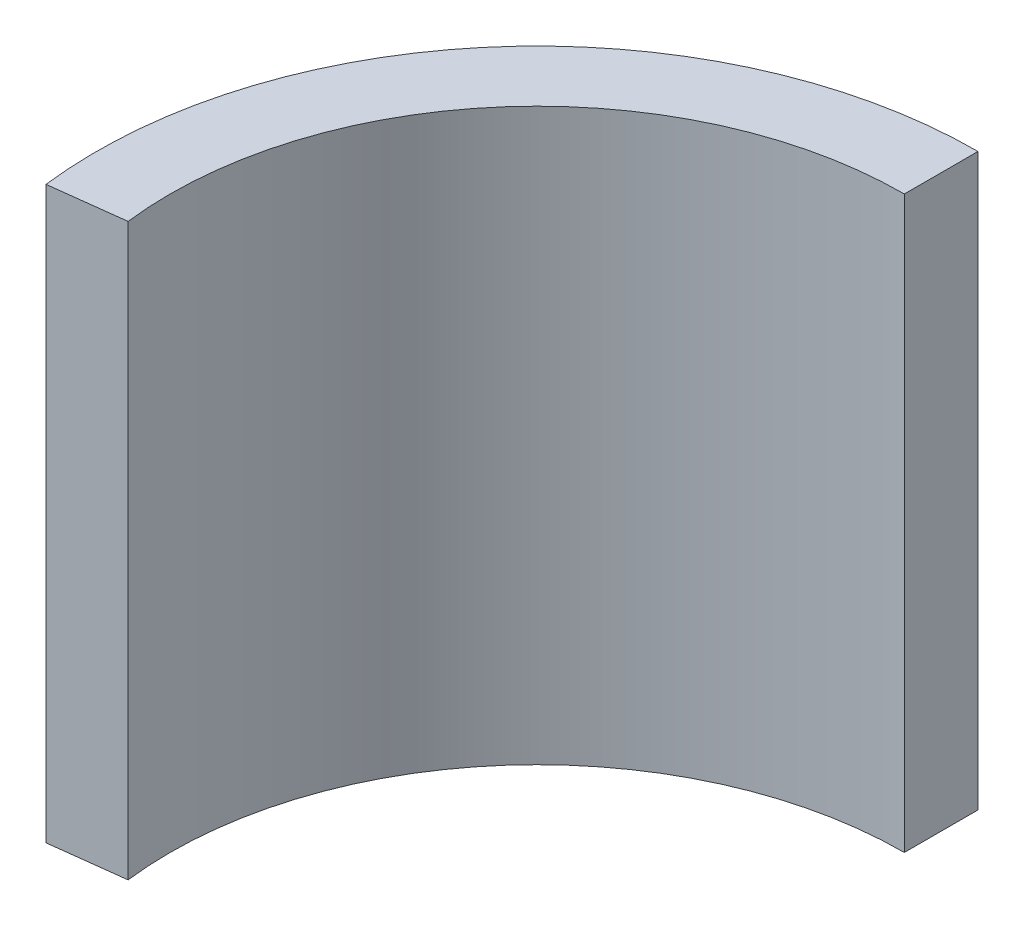
from build123d import *

# Parameters (mm, degrees)
REVOLVESKETCH_W       = 3.1
REVOLVESKETCH_H       = 24
THINBOSSREVOLVE_ANGLE = 97


with BuildPart() as part:
    # RevolveSketch → ThinBossRevolve (revolve)
    with BuildSketch(Plane(origin=(0, 0, 0), x_dir=(0, 0, -1), z_dir=(1, 0, 0))):
        with Locations((11, 3)):
            Rectangle(REVOLVESKETCH_W, REVOLVESKETCH_H)
    revolve(axis=Axis((0, -18, 6), (0, 1, 0)), revolution_arc=THINBOSSREVOLVE_ANGLE)


solid = part.part
